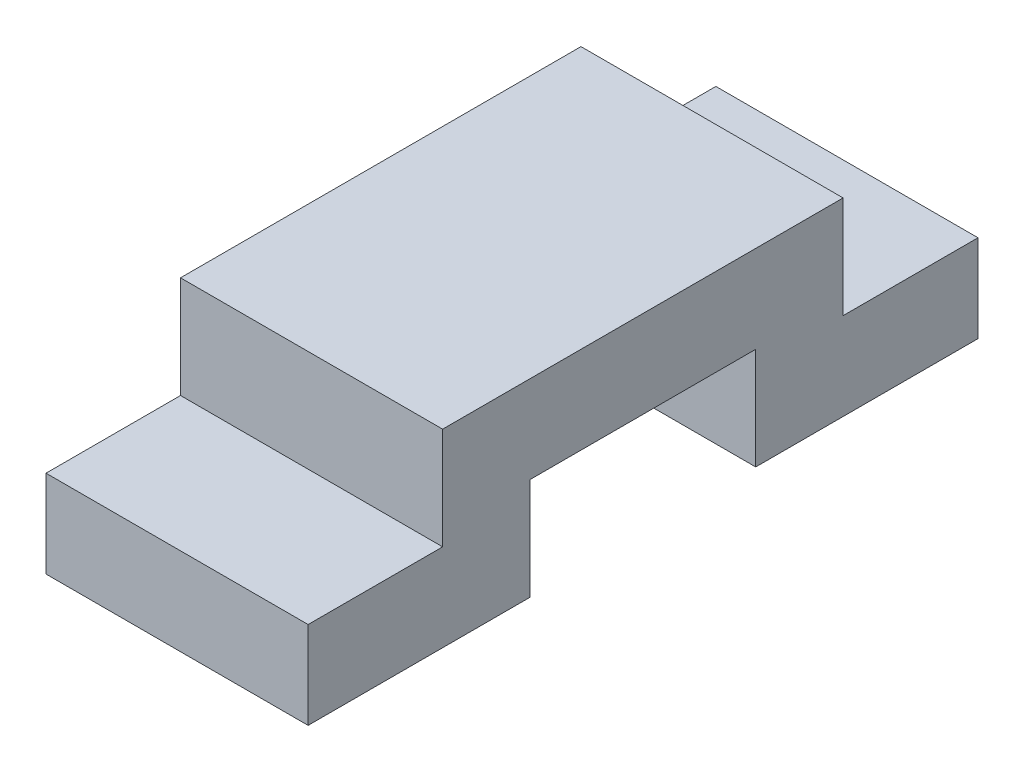
from build123d import *

# Parameters (mm, degrees)
SKETCH1_W           = 9
SKETCH1_H           = 23
BOSS_EXTRUDE1_DEPTH = 15
SKETCH2_W           = 7.75
SKETCH2_H           = 3.5
CUT_EXTRUDE1_DEPTH  = 15


with BuildPart() as part:
    # Sketch1 → Boss-Extrude1 (new body)
    with BuildSketch(Plane(origin=(0, 0, 0), x_dir=(1, 0, 0), z_dir=(0, 1, 0))):
        with Locations((4.5, 11.721182832)):
            Rectangle(SKETCH1_W, SKETCH1_H)
    extrude(amount=BOSS_EXTRUDE1_DEPTH)

    # Sketch2 → Cut-Extrude1 (cut)
    with BuildSketch(Plane(origin=(9, 0, 0), x_dir=(0, 0, -1), z_dir=(1, 0, 0))):
        Polygon((0.221182832, 3), (4.83959223, 3), (4.83959223, 6.5), (18.58959223, 6.5), (18.58959223, 3), (23.221182832, 3), (23.221182832, 15), (0.221182832, 15), align=None)
        with Locations((11.71459223, 1.75)):
            Rectangle(SKETCH2_W, SKETCH2_H)
    extrude(amount=-CUT_EXTRUDE1_DEPTH, mode=Mode.SUBTRACT)


solid = part.part
